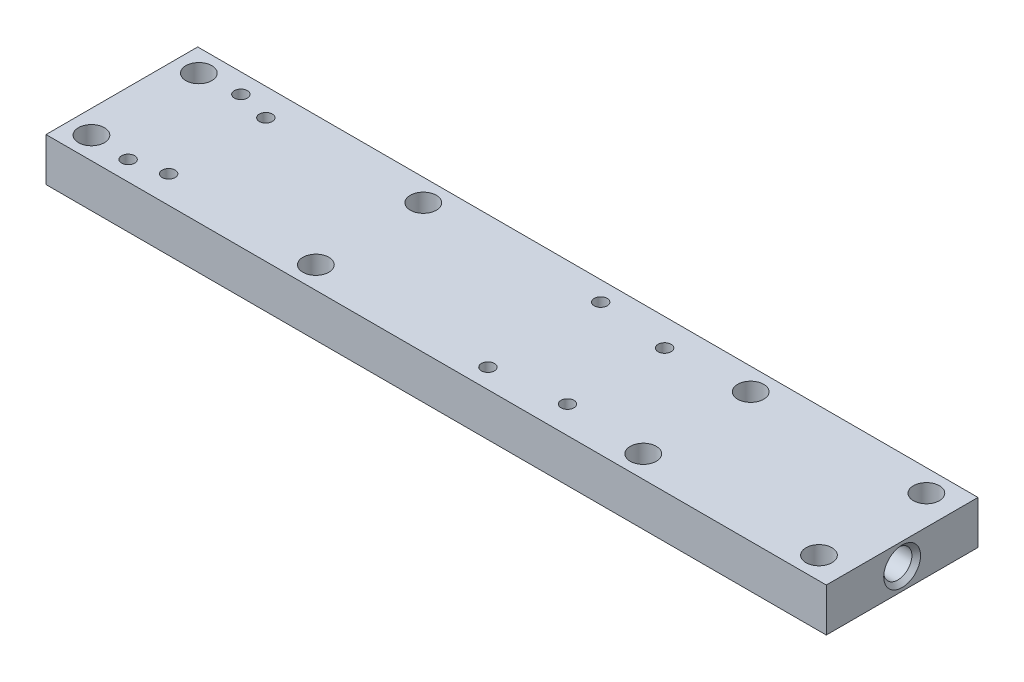
from build123d import *

# Parameters (mm, degrees)
SKETCH1_W           = 180
SKETCH1_H           = 35
BOSS_EXTRUDE1_DEPTH = 5
SKETCH3_R           = 3.25
CUT_EXTRUDE1_DEPTH  = 181.917799014
CHAMFER1_SIZE       = 1
CHAMFER2_SIZE       = 1
SKETCH5_R           = 1.5
CUT_EXTRUDE2_DEPTH  = 10
SKETCH18_R          = 1.5
CUT_EXTRUDE3_DEPTH  = 36
SKETCH19_R          = 3
CUT_EXTRUDE4_DEPTH  = 10


with BuildPart() as part:
    # Sketch1 → Boss-Extrude1 (new, symmetric)
    with BuildSketch(Plane(origin=(0, 0, 0), x_dir=(1, 0, 0), z_dir=(0, 1, 0))):
        Rectangle(SKETCH1_W, SKETCH1_H)
    extrude(amount=BOSS_EXTRUDE1_DEPTH, both=True)

    # Sketch3 → Cut-Extrude1 (cut, through all)
    with BuildSketch(Plane(origin=(90, 0, 0), x_dir=(0, 0, -1), z_dir=(1, 0, 0))):
        Circle(SKETCH3_R)
    extrude(amount=-CUT_EXTRUDE1_DEPTH, mode=Mode.SUBTRACT)

    # Chamfer1
    chamfer1_edges = [part.edges().sort_by_distance(p)[0] for p in [
        (90, 0, 3.25),
    ]]
    chamfer(chamfer1_edges, length=CHAMFER1_SIZE)

    # Chamfer2
    chamfer2_edges = [part.edges().sort_by_distance(p)[0] for p in [
        (-90, 0, 3.25),
    ]]
    chamfer(chamfer2_edges, length=CHAMFER2_SIZE)

    # Sketch5 → Cut-Extrude2 (cut)
    with BuildSketch(Plane(origin=(0, 5, 0), x_dir=(1, 0, 0), z_dir=(0, 1, 0))):
        with Locations(Location((-68, -11.2, 0), (0, 0, 270))):
            Circle(SKETCH5_R)
        with Locations(Location((-68, 11.2, 0), (0, 0, 270))):
            Circle(SKETCH5_R)
        with Locations(Location((24, 11.2, 0), (0, 0, 270))):
            Circle(SKETCH5_R)
        with Locations(Location((24, -11.2, 0), (0, 0, 270))):
            Circle(SKETCH5_R)
    extrude(amount=-CUT_EXTRUDE2_DEPTH, mode=Mode.SUBTRACT)

    # Sketch18 → Cut-Extrude3 (cut)
    with BuildSketch(Plane(origin=(0, 5, 0), x_dir=(1, 0, 0), z_dir=(0, 1, 0))):
        with Locations(Location((-75.552597146, 13, 0), (0, 0, 270))):
            Circle(SKETCH18_R)
        with Locations(Location((-75.552597146, -13, 0), (0, 0, 270))):
            Circle(SKETCH18_R)
        with Locations(Location((7.447402854, -13, 0), (0, 0, 270))):
            Circle(SKETCH18_R)
        with Locations(Location((7.447402854, 13, 0), (0, 0, 270))):
            Circle(SKETCH18_R)
    extrude(amount=-CUT_EXTRUDE3_DEPTH, mode=Mode.SUBTRACT)

    # Sketch19 → Cut-Extrude4 (cut)
    with BuildSketch(Plane(origin=(0, 5, 0), x_dir=(1, 0, 0), z_dir=(0, 1, 0))):
        with Locations(Location((-84.632352591, 12.390150385, 0), (0, 0, 270))):
            Circle(SKETCH19_R)
        with Locations(Location((-84.632352591, -12.390150385, 0), (0, 0, 270))):
            Circle(SKETCH19_R)
        with Locations(Location((83.204027378, 12.390150385, 0), (0, 0, 270))):
            Circle(SKETCH19_R)
        with Locations(Location((83.204027378, -12.390150385, 0), (0, 0, 270))):
            Circle(SKETCH19_R)
        with Locations(Location((42.676245092, -12.390150385, 0), (0, 0, 270))):
            Circle(SKETCH19_R)
        with Locations(Location((42.676245092, 12.390150385, 0), (0, 0, 270))):
            Circle(SKETCH19_R)
        with Locations(Location((-32.852727664, -12.390150385, 0), (0, 0, 270))):
            Circle(SKETCH19_R)
        with Locations(Location((-32.852727664, 12.390150385, 0), (0, 0, 270))):
            Circle(SKETCH19_R)
    extrude(amount=-CUT_EXTRUDE4_DEPTH, mode=Mode.SUBTRACT)


solid = part.part
